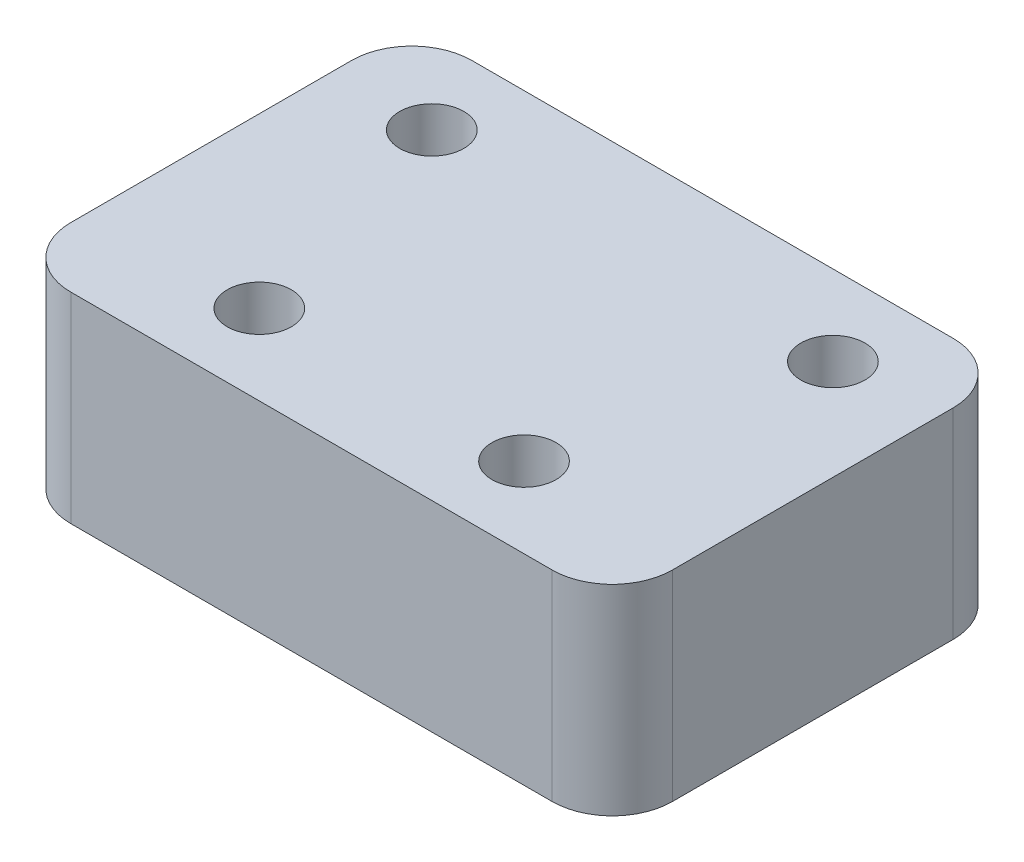
from build123d import *

# Parameters (mm, degrees)
SKETCH2_W           = 30
SKETCH2_H           = 20
SKETCH2_R           = 1.6
BOSS_EXTRUDE1_DEPTH = 10
FILLET1_R           = 3


with BuildPart() as part:
    # Sketch2 → Boss-Extrude1 (new body)
    with BuildSketch(Plane(origin=(0, 0, 0), x_dir=(1, 0, 0), z_dir=(0, 1, 0))):
        with Locations((15, 10)):
            Rectangle(SKETCH2_W, SKETCH2_H)
        with Locations(Location((5, 16, 0), (0, 0, 270))):
            Circle(SKETCH2_R, mode=Mode.SUBTRACT)
        with Locations(Location((25, 16, 0), (0, 0, 270))):
            Circle(SKETCH2_R, mode=Mode.SUBTRACT)
        with Locations(Location((8.4, 4, 0), (0, 0, 270))):
            Circle(SKETCH2_R, mode=Mode.SUBTRACT)
        with Locations(Location((21.6, 4, 0), (0, 0, 270))):
            Circle(SKETCH2_R, mode=Mode.SUBTRACT)
    extrude(amount=BOSS_EXTRUDE1_DEPTH)

    # Fillet1
    fillet1_edges = [part.edges().sort_by_distance(p)[0] for p in [
        (0, 5, -20),
        (30, 5, -20),
        (30, 5, 0),
        (0, 5, 0),
    ]]
    fillet(fillet1_edges, radius=FILLET1_R)


solid = part.part
